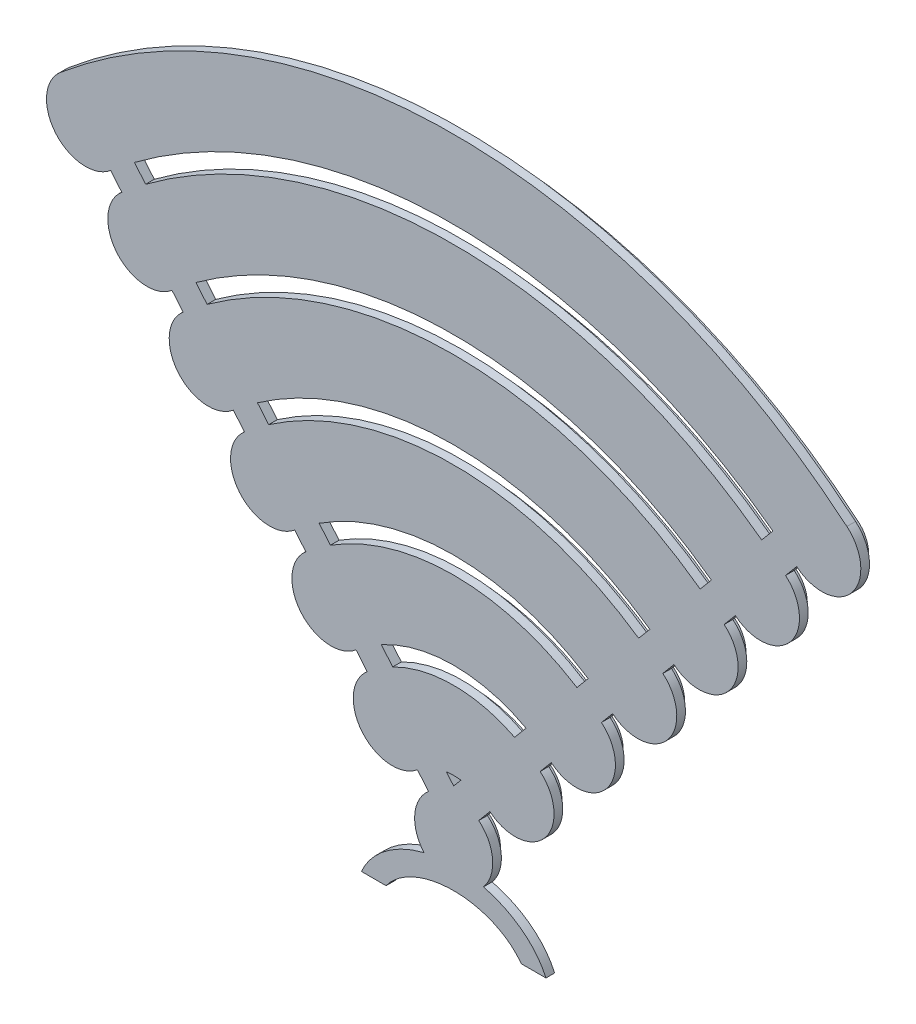
from build123d import *

# Parameters (mm, degrees)
BOSS_EXTRUDE1_DEPTH      = 1
BOSS_EXTRUDE1_DEPTH_BACK = 1
SKETCH2_R                = 6.8
SKETCH2_R_2              = 4.8
BOSS_EXTRUDE2_DEPTH      = 2


with BuildPart() as part:
    # Sketch1 → Boss-Extrude1 (new, two sides: drawn at the far end of the back side and taken through both)
    with BuildSketch(Plane.XY.offset(-BOSS_EXTRUDE1_DEPTH_BACK)):
        with BuildLine():
            Line((-79.062875991, 94.223466504), (-76.491725553, 91.159288731))
            ThreePointArc((-76.491725553, 91.159288731), (-77.601037054, 78.479800256), (-64.921548578, 77.370488755))
            Line((-64.921548578, 77.370488755), (-62.35039814, 74.306310983))
            ThreePointArc((-62.35039814, 74.306310983), (-63.45970964, 61.626822507), (-50.780221165, 60.517511006))
            Line((-50.780221165, 60.517511006), (-48.209070726, 57.453333234))
            ThreePointArc((-48.209070726, 57.453333234), (-49.318382227, 44.773844759), (-36.638893752, 43.664533258))
            Line((-36.638893752, 43.664533258), (-34.067743313, 40.600355485))
            ThreePointArc((-34.067743313, 40.600355485), (-35.177054814, 27.92086701), (-22.497566339, 26.811555509))
            Line((-22.497566339, 26.811555509), (-19.9264159, 23.747377737))
            ThreePointArc((-19.9264159, 23.747377737), (-21.035727401, 11.067889261), (-8.356238926, 9.958577761))
            Line((-8.356238926, 9.958577761), (-5.785088487, 6.894399988))
            ThreePointArc((-5.785088487, 6.894399988), (-8.968372241, 0.753856314), (-6.854827722, -5.831923945))
            add(Edge.make_bspline(
                [(-6.854827722, -5.831923945), (-17.598880273, -8.504870382), (-21.273035539, -16.800000012)],
                knots=[1.880376726, 1.880376726, 1.880376726, 2.809825541, 2.809825541, 2.809825541], degree=2, weights=[1, 0.893945114, 1]))
            Line((-21.273035539, -16.800000012), (-15.574646072, -16.800000012))
            add(Edge.make_bspline(
                [(15.574646072, -16.800000012), (0, 4.91228076), (-15.574646072, -16.800000012)],
                knots=[3.615088165, 3.615088165, 3.615088165, 5.809689796, 5.809689796, 5.809689796], degree=2, weights=[1, 0.455999999, 1]))
            Line((15.574646072, -16.800000012), (21.273035539, -16.800000012))
            add(Edge.make_bspline(
                [(21.273035539, -16.800000012), (17.598880273, -8.504870382), (6.854827722, -5.831923945)],
                knots=[0.331767113, 0.331767113, 0.331767113, 1.261215927, 1.261215927, 1.261215927], degree=2, weights=[1, 0.893945114, 1]))
            ThreePointArc((6.854827722, -5.831923945), (8.968372241, 0.753856314), (5.785088487, 6.894399988))
            Line((5.785088487, 6.894399988), (8.356238926, 9.958577761))
            ThreePointArc((8.356238926, 9.958577761), (21.035727401, 11.067889261), (19.9264159, 23.747377737))
            Line((19.9264159, 23.747377737), (22.497566339, 26.811555509))
            ThreePointArc((22.497566339, 26.811555509), (35.177054814, 27.92086701), (34.067743313, 40.600355485))
            Line((34.067743313, 40.600355485), (36.638893752, 43.664533258))
            ThreePointArc((36.638893752, 43.664533258), (49.318382227, 44.773844759), (48.209070726, 57.453333234))
            Line((48.209070726, 57.453333234), (50.780221165, 60.517511006))
            ThreePointArc((50.780221165, 60.517511006), (63.45970964, 61.626822507), (62.35039814, 74.306310983))
            Line((62.35039814, 74.306310983), (64.921548578, 77.370488755))
            ThreePointArc((64.921548578, 77.370488755), (77.601037054, 78.479800256), (76.491725553, 91.159288731))
            Line((76.491725553, 91.159288731), (79.062875991, 94.223466504))
            ThreePointArc((79.062875991, 94.223466504), (91.742364467, 95.332778005), (90.633052966, 108.01226648))
            ThreePointArc((90.633052966, 108.01226648), (0, 141), (-90.633052966, 108.01226648))
            ThreePointArc((-90.633052966, 108.01226648), (-91.742364467, 95.332778005), (-79.062875991, 94.223466504))
        make_face()
        with BuildLine():
            Line((-73.572426121, 98.570269933), (-70.996961147, 95.500950298))
            ThreePointArc((-70.996961147, 95.500950298), (0, 119), (70.996961147, 95.500950298))
            Line((70.996961147, 95.500950298), (73.572426121, 98.570269933))
            ThreePointArc((73.572426121, 98.570269933), (0, 123), (-73.572426121, 98.570269933))
        make_face(mode=Mode.SUBTRACT)
        with BuildLine():
            Line((-59.403126055, 81.683955676), (-56.825521539, 78.612086233))
            ThreePointArc((-56.825521539, 78.612086233), (0, 97), (56.825521539, 78.612086233))
            Line((56.825521539, 78.612086233), (59.403126055, 81.683955676))
            ThreePointArc((59.403126055, 81.683955676), (0, 101), (-59.403126055, 81.683955676))
        make_face(mode=Mode.SUBTRACT)
        with BuildLine():
            Line((-45.218171715, 64.778985379), (-42.636323052, 61.702057961))
            ThreePointArc((-42.636323052, 61.702057961), (0, 75), (42.636323052, 61.702057961))
            Line((42.636323052, 61.702057961), (45.218171715, 64.778985379))
            ThreePointArc((45.218171715, 64.778985379), (0, 79), (-45.218171715, 64.778985379))
        make_face(mode=Mode.SUBTRACT)
        with BuildLine():
            Line((-30.999247112, 47.833530901), (-28.406987304, 44.744195962))
            ThreePointArc((-28.406987304, 44.744195962), (0, 53), (28.406987304, 44.744195962))
            Line((28.406987304, 44.744195962), (30.999247112, 47.833530901))
            ThreePointArc((30.999247112, 47.833530901), (0, 57), (-30.999247112, 47.833530901))
        make_face(mode=Mode.SUBTRACT)
        with BuildLine():
            Line((-16.680712092, 30.769365351), (-14.049449019, 27.63354813))
            ThreePointArc((-14.049449019, 27.63354813), (0, 31), (14.049449019, 27.63354813))
            Line((14.049449019, 27.63354813), (16.680712092, 30.769365351))
            ThreePointArc((16.680712092, 30.769365351), (0, 35), (-16.680712092, 30.769365351))
        make_face(mode=Mode.SUBTRACT)
        with BuildLine():
            Line((-1.679074368, 12.891109699), (0, 10.890066788))
            Line((0, 10.890066788), (1.679074368, 12.891109699))
            ThreePointArc((1.679074368, 12.891109699), (0, 13), (-1.679074368, 12.891109699))
        make_face(mode=Mode.SUBTRACT)
    extrude(amount=BOSS_EXTRUDE1_DEPTH + BOSS_EXTRUDE1_DEPTH_BACK)

    # Sketch2 → Boss-Extrude2 (add)
    # profile 1 of 7: a face of its own
    with BuildSketch(Plane(origin=(0, 0, -1), x_dir=(-1, 0, 0), z_dir=(0, 0, -1))):
        Circle(SKETCH2_R)
        Circle(SKETCH2_R_2, mode=Mode.SUBTRACT)
    # profile 2 of 7: a face of its own
    with BuildSketch(Plane(origin=(0, 0, -1), x_dir=(-1, 0, 0), z_dir=(0, 0, -1))):
        with BuildLine():
            ThreePointArc((80.477008733, 95.908764278), (0, 125.2), (-80.477008733, 95.908764278))
            ThreePointArc((-80.477008733, 95.908764278), (-90.057066692, 96.746910746), (-89.218920224, 106.326968705))
            ThreePointArc((-89.218920224, 106.326968705), (0, 138.8), (89.218920224, 106.326968705))
            ThreePointArc((89.218920224, 106.326968705), (90.057066692, 96.746910746), (80.477008733, 95.908764278))
        make_face()
        with BuildLine():
            ThreePointArc((81.762583952, 97.440853165), (0, 127.2), (-81.762583952, 97.440853165))
            ThreePointArc((-81.762583952, 97.440853165), (-88.524977806, 98.032485965), (-87.933345005, 104.794879819))
            ThreePointArc((-87.933345005, 104.794879819), (0, 136.8), (87.933345005, 104.794879819))
            ThreePointArc((87.933345005, 104.794879819), (88.524977806, 98.032485965), (81.762583952, 97.440853165))
        make_face(mode=Mode.SUBTRACT)
    # profile 3 of 7: a face of its own
    with BuildSketch(Plane(origin=(0, 0, -1), x_dir=(-1, 0, 0), z_dir=(0, 0, -1))):
        with BuildLine():
            ThreePointArc((75.077592811, 89.473990956), (0, 116.8), (-75.077592811, 89.473990956))
            ThreePointArc((-75.077592811, 89.473990956), (-75.915739279, 79.893932997), (-66.33568132, 79.05578653))
            ThreePointArc((-66.33568132, 79.05578653), (0, 103.2), (66.33568132, 79.05578653))
            ThreePointArc((66.33568132, 79.05578653), (75.915739279, 79.893932997), (75.077592811, 89.473990956))
        make_face()
        with BuildLine():
            ThreePointArc((73.792017592, 87.94190207), (0, 114.8), (-73.792017592, 87.94190207))
            ThreePointArc((-73.792017592, 87.94190207), (-74.383650392, 81.179508217), (-67.621256539, 80.587875416))
            ThreePointArc((-67.621256539, 80.587875416), (0, 105.2), (67.621256539, 80.587875416))
            ThreePointArc((67.621256539, 80.587875416), (74.383650392, 81.179508217), (73.792017592, 87.94190207))
        make_face(mode=Mode.SUBTRACT)
    # profile 4 of 7: a face of its own
    with BuildSketch(Plane(origin=(0, 0, -1), x_dir=(-1, 0, 0), z_dir=(0, 0, -1))):
        with BuildLine():
            ThreePointArc((23.91169908, 28.496853284), (33.491757039, 29.334999751), (32.653610572, 38.91505771))
            ThreePointArc((32.653610572, 38.91505771), (0, 50.8), (-32.653610572, 38.91505771))
            ThreePointArc((-32.653610572, 38.91505771), (-33.491757039, 29.334999751), (-23.91169908, 28.496853284))
            ThreePointArc((-23.91169908, 28.496853284), (0, 37.2), (23.91169908, 28.496853284))
        make_face()
        with BuildLine():
            ThreePointArc((25.1972743, 30.02894217), (31.959668153, 30.620574971), (31.368035353, 37.382968824))
            ThreePointArc((31.368035353, 37.382968824), (0, 48.8), (-31.368035353, 37.382968824))
            ThreePointArc((-31.368035353, 37.382968824), (-31.959668153, 30.620574971), (-25.1972743, 30.02894217))
            ThreePointArc((-25.1972743, 30.02894217), (0, 39.2), (25.1972743, 30.02894217))
        make_face(mode=Mode.SUBTRACT)
    # profile 5 of 7: a face of its own
    with BuildSketch(Plane(origin=(0, 0, -1), x_dir=(-1, 0, 0), z_dir=(0, 0, -1))):
        with BuildLine():
            ThreePointArc((38.053026493, 45.349831033), (47.633084453, 46.1879775), (46.794937985, 55.768035459))
            ThreePointArc((46.794937985, 55.768035459), (0, 72.8), (-46.794937985, 55.768035459))
            ThreePointArc((-46.794937985, 55.768035459), (-47.633084453, 46.1879775), (-38.053026493, 45.349831033))
            ThreePointArc((-38.053026493, 45.349831033), (0, 59.2), (38.053026493, 45.349831033))
        make_face()
        with BuildLine():
            ThreePointArc((39.338601713, 46.881919919), (46.100995566, 47.473552719), (45.509362766, 54.235946573))
            ThreePointArc((45.509362766, 54.235946573), (0, 70.8), (-45.509362766, 54.235946573))
            ThreePointArc((-45.509362766, 54.235946573), (-46.100995566, 47.473552719), (-39.338601713, 46.881919919))
            ThreePointArc((-39.338601713, 46.881919919), (0, 61.2), (39.338601713, 46.881919919))
        make_face(mode=Mode.SUBTRACT)
    # profile 6 of 7: a face of its own
    with BuildSketch(Plane(origin=(0, 0, -1), x_dir=(-1, 0, 0), z_dir=(0, 0, -1))):
        with BuildLine():
            ThreePointArc((52.194353907, 62.202808781), (61.774411866, 63.040955249), (60.936265398, 72.621013208))
            ThreePointArc((60.936265398, 72.621013208), (0, 94.8), (-60.936265398, 72.621013208))
            ThreePointArc((-60.936265398, 72.621013208), (-61.774411866, 63.040955249), (-52.194353907, 62.202808781))
            ThreePointArc((-52.194353907, 62.202808781), (0, 81.2), (52.194353907, 62.202808781))
        make_face()
        with BuildLine():
            ThreePointArc((53.479929126, 63.734897667), (60.242322979, 64.326530468), (59.650690179, 71.088924321))
            ThreePointArc((59.650690179, 71.088924321), (0, 92.8), (-59.650690179, 71.088924321))
            ThreePointArc((-59.650690179, 71.088924321), (-60.242322979, 64.326530468), (-53.479929126, 63.734897667))
            ThreePointArc((-53.479929126, 63.734897667), (0, 83.2), (53.479929126, 63.734897667))
        make_face(mode=Mode.SUBTRACT)
    # profile 7 of 7: a face of its own
    with BuildSketch(Plane(origin=(0, 0, -1), x_dir=(-1, 0, 0), z_dir=(0, 0, -1))):
        with BuildLine():
            ThreePointArc((-18.512283159, 22.062079962), (-19.350429626, 12.482022003), (-9.770371667, 11.643875535))
            ThreePointArc((-9.770371667, 11.643875535), (0, 15.2), (9.770371667, 11.643875535))
            ThreePointArc((9.770371667, 11.643875535), (19.350429626, 12.482022003), (18.512283159, 22.062079962))
            ThreePointArc((18.512283159, 22.062079962), (0, 28.8), (-18.512283159, 22.062079962))
        make_face()
        with BuildLine():
            ThreePointArc((-17.22670794, 20.529991076), (-17.81834074, 13.767597222), (-11.055946887, 13.175964422))
            ThreePointArc((-11.055946887, 13.175964422), (0, 17.2), (11.055946887, 13.175964422))
            ThreePointArc((11.055946887, 13.175964422), (17.81834074, 13.767597222), (17.22670794, 20.529991076))
            ThreePointArc((17.22670794, 20.529991076), (0, 26.8), (-17.22670794, 20.529991076))
        make_face(mode=Mode.SUBTRACT)
    extrude(amount=BOSS_EXTRUDE2_DEPTH)


solid = part.part
